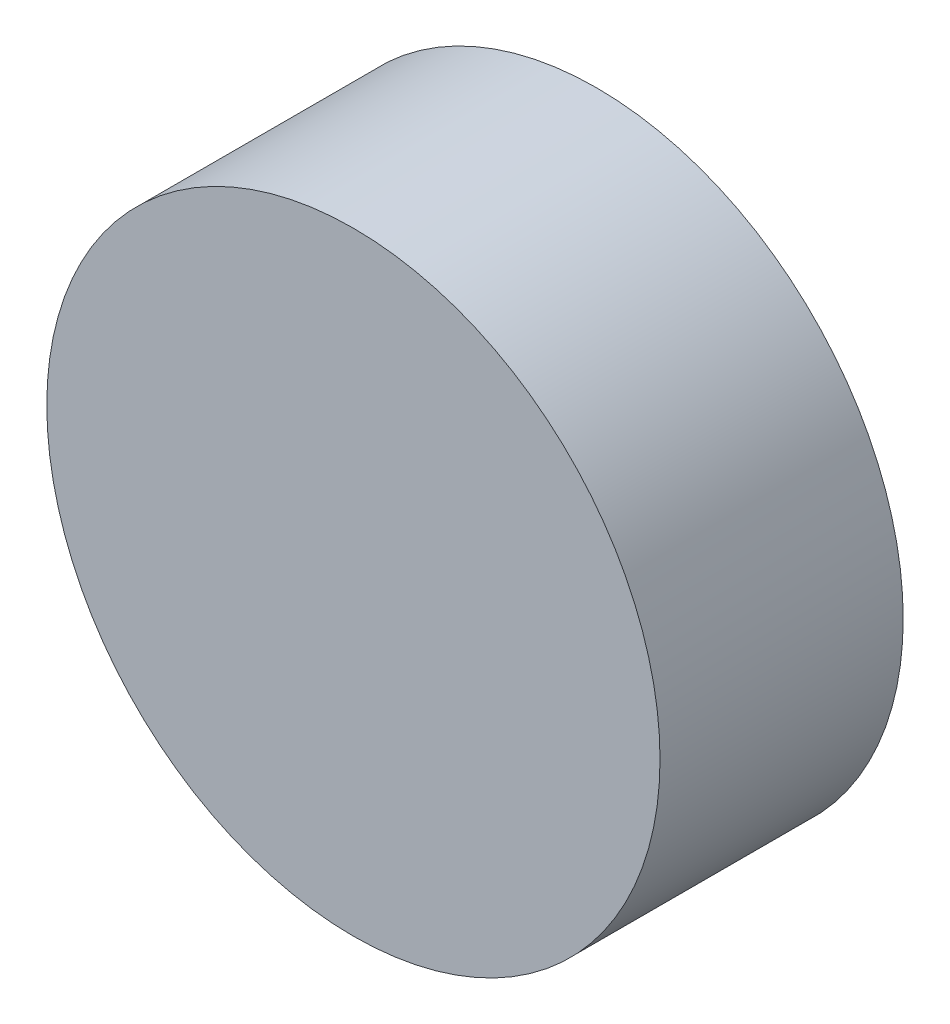
from build123d import *

# Parameters (mm, degrees)
SKETCH1_R           = 5.8
BOSS_EXTRUDE1_DEPTH = 4.5999908


with BuildPart() as part:
    # Sketch1 → Boss-Extrude1 (new body)
    with BuildSketch(Plane.XY):
        Circle(SKETCH1_R)
    extrude(amount=BOSS_EXTRUDE1_DEPTH)


solid = part.part
